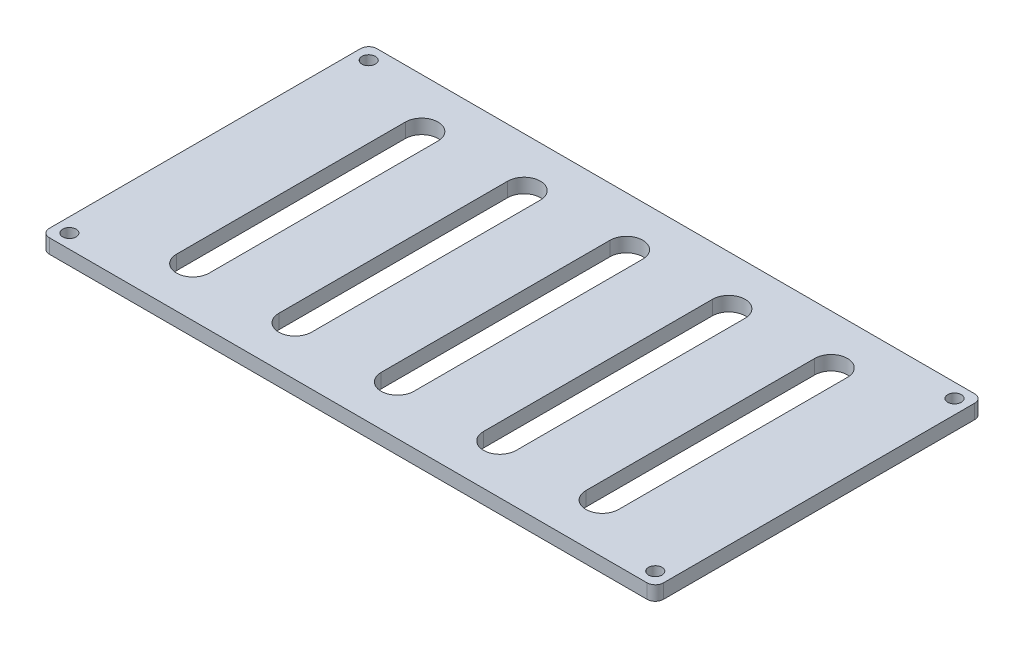
from build123d import *

# Parameters (mm, degrees)
SKETCH1_R           = 1.65
BOSS_EXTRUDE1_DEPTH = 3.5


with BuildPart() as part:
    # Sketch1 → Boss-Extrude1 (new body)
    with BuildSketch(Plane(origin=(0, 0, 0), x_dir=(1, 0, 0), z_dir=(0, 1, 0))):
        with BuildLine():
            ThreePointArc((-75, 38), (-74.414213562, 39.414213562), (-73, 40))
            Line((-73, 40), (73, 40))
            ThreePointArc((73, 40), (74.414213562, 39.414213562), (75, 38))
            Line((75, 38), (75, -38))
            ThreePointArc((75, -38), (74.414213562, -39.414213562), (73, -40))
            Line((73, -40), (-73, -40))
            ThreePointArc((-73, -40), (-74.414213562, -39.414213562), (-75, -38))
            Line((-75, -38), (-75, 38))
        make_face()
        with Locations(Location((71.542893219, 36.542893219, 0), (0, 0, 270))):
            Circle(SKETCH1_R, mode=Mode.SUBTRACT)
        with Locations(Location((-71.542893219, 36.542893219, 0), (0, 0, 270))):
            Circle(SKETCH1_R, mode=Mode.SUBTRACT)
        with Locations(Location((71.542893219, -36.552437932, 0), (0, 0, 270))):
            Circle(SKETCH1_R, mode=Mode.SUBTRACT)
        with Locations(Location((-71.542893219, -36.552437932, 0), (0, 0, 270))):
            Circle(SKETCH1_R, mode=Mode.SUBTRACT)
        with BuildLine():
            ThreePointArc((-46, 27.948088576), (-50, 31.948088576), (-54, 27.948088576))
            Line((-54, 27.948088576), (-54, -27.957633289))
            ThreePointArc((-54, -27.957633289), (-50, -31.957633289), (-46, -27.957633289))
            Line((-46, -27.957633289), (-46, 27.948088576))
        make_face(mode=Mode.SUBTRACT)
        with BuildLine():
            ThreePointArc((-21, 27.948088576), (-25, 31.948088576), (-29, 27.948088576))
            Line((-29, 27.948088576), (-29, -27.957633289))
            ThreePointArc((-29, -27.957633289), (-25, -31.957633289), (-21, -27.957633289))
            Line((-21, -27.957633289), (-21, 27.948088576))
        make_face(mode=Mode.SUBTRACT)
        with BuildLine():
            ThreePointArc((54, 27.948088576), (50, 31.948088576), (46, 27.948088576))
            Line((46, 27.948088576), (46, -27.957633289))
            ThreePointArc((46, -27.957633289), (50, -31.957633289), (54, -27.957633289))
            Line((54, -27.957633289), (54, 27.948088576))
        make_face(mode=Mode.SUBTRACT)
        with BuildLine():
            ThreePointArc((29, 27.948088576), (25, 31.948088576), (21, 27.948088576))
            Line((21, 27.948088576), (21, -27.957633289))
            ThreePointArc((21, -27.957633289), (25, -31.957633289), (29, -27.957633289))
            Line((29, -27.957633289), (29, 27.948088576))
        make_face(mode=Mode.SUBTRACT)
        with BuildLine():
            ThreePointArc((4, 27.948088576), (0, 31.948088576), (-4, 27.948088576))
            Line((-4, 27.948088576), (-4, -27.957633289))
            ThreePointArc((-4, -27.957633289), (0, -31.957633289), (4, -27.957633289))
            Line((4, -27.957633289), (4, 27.948088576))
        make_face(mode=Mode.SUBTRACT)
    extrude(amount=BOSS_EXTRUDE1_DEPTH)


solid = part.part
